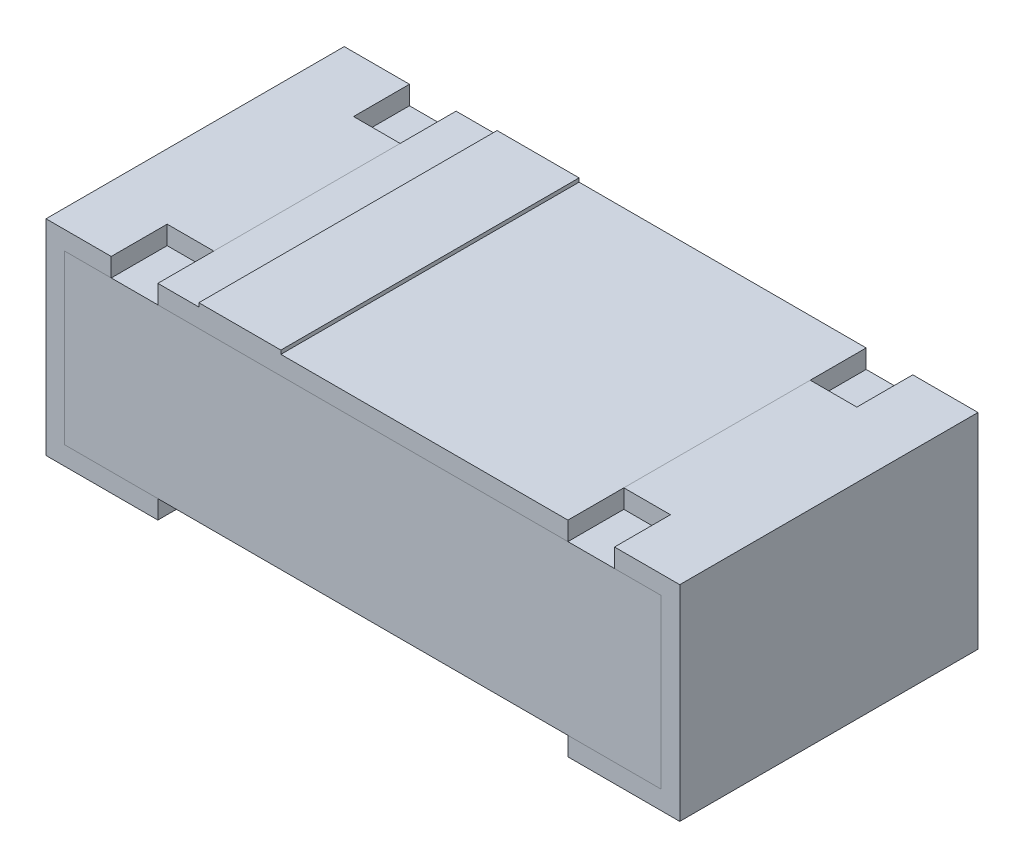
from build123d import *

# Parameters (mm, degrees)
CROQUIS1_W          = 1.6
CROQUIS1_H          = 0.8
EXTRUIR1_DEPTH      = 0.5
CROQUIS2_W          = 1.6
CROQUIS2_H          = 0.05
EXTRUIR2_DEPTH      = 2.236931688
CROQUIS4_W          = 0.8
CROQUIS4_H          = 0.05
EXTRUIR3_DEPTH      = 1.1
CROQUIS5_W          = 0.125
CROQUIS5_H          = 0.15
EXTRUIR4_DEPTH      = 0.05
SKETCH1_W           = 0.22
SKETCH1_H           = 0.8
BOSS_EXTRUDE1_DEPTH = 0.01


with BuildPart() as part:
    # Croquis1 → Extruir1 (new body)
    with BuildSketch(Plane(origin=(0, 0, 0), x_dir=(1, 0, 0), z_dir=(0, 1, 0))):
        Rectangle(CROQUIS1_W, CROQUIS1_H)
    extrude(amount=EXTRUIR1_DEPTH)

    # Croquis2 → Extruir2 (cut, through all)
    with BuildSketch(Plane.XY.offset(0.4)):
        with Locations((0, 0.025)):
            Rectangle(CROQUIS2_W, CROQUIS2_H)
    extrude(amount=-EXTRUIR2_DEPTH, mode=Mode.SUBTRACT)


with BuildPart() as body_2:
    # Barrer1: sweep along a path in Croquis3
    with BuildLine(Plane.XY.offset(0.4)) as barrer1_path:
        Line((-0.55, 0.55), (-0.85, 0.55))
        Line((-0.85, 0.55), (-0.85, 0))
        Line((-0.85, 0), (-0.55, 0))
    # Croquis3D1 → Barrer1 (sweep)
    with BuildSketch(Plane(origin=(-0.55, 0.55, 0.4), x_dir=(0, -0.06237828615518069, -0.9980525784828886), z_dir=(1, 0, 0))):
        Polygon((0, 0), (0.798442063, 0.049902629), (0.801560977, 0), (0.003118914, -0.049902629), align=None)
    sweep(path=barrer1_path.line, transition=Transition.RIGHT)


with BuildPart() as body_3:
    # Simetría1: mirrored copy
    add(body_2.part.mirror(Plane(origin=(0, 0.5, 0.4), x_dir=(0, 0, 1), z_dir=(1, 0, 0))))


with BuildPart() as body_4:
    # Croquis4 → Extruir3 (new body)
    with BuildSketch(Plane(origin=(-0.55, 0, 0), x_dir=(0, 0, -1), z_dir=(1, 0, 0))):
        with Locations((0, 0.525)):
            Rectangle(CROQUIS4_W, CROQUIS4_H)
    extrude(amount=EXTRUIR3_DEPTH)

    # Sketch1 → Boss-Extrude1 (add)
    with BuildSketch(Plane(origin=(0, 0.55, 0), x_dir=(1, 0, 0), z_dir=(0, 1, 0))):
        with Locations((-0.33, 0)):
            Rectangle(SKETCH1_W, SKETCH1_H)
    extrude(amount=BOSS_EXTRUDE1_DEPTH)


with BuildPart() as extruir4_tool:
    # Croquis5 → Extruir4 (new body)
    with BuildSketch(Plane(origin=(0, 0.55, 0), x_dir=(1, 0, 0), z_dir=(0, 1, 0))):
        with Locations((-0.6125, -0.325)):
            Rectangle(CROQUIS5_W, CROQUIS5_H)
        with Locations((-0.6125, 0.325)):
            Rectangle(CROQUIS5_W, CROQUIS5_H)
        with Locations((0.6125, 0.325)):
            Rectangle(CROQUIS5_W, CROQUIS5_H)
        with Locations((0.6125, -0.325)):
            Rectangle(CROQUIS5_W, CROQUIS5_H)
    extrude(amount=-EXTRUIR4_DEPTH)


with BuildPart() as body_2_1:
    add(body_2.part)

    # Extruir4: cut by extruir4_tool
    add(extruir4_tool.part, mode=Mode.SUBTRACT)


with BuildPart() as body_3_1:
    add(body_3.part)

    # Extruir4: cut by extruir4_tool
    add(extruir4_tool.part, mode=Mode.SUBTRACT)


solid = Compound([part.part, body_4.part, body_2_1.part, body_3_1.part])
